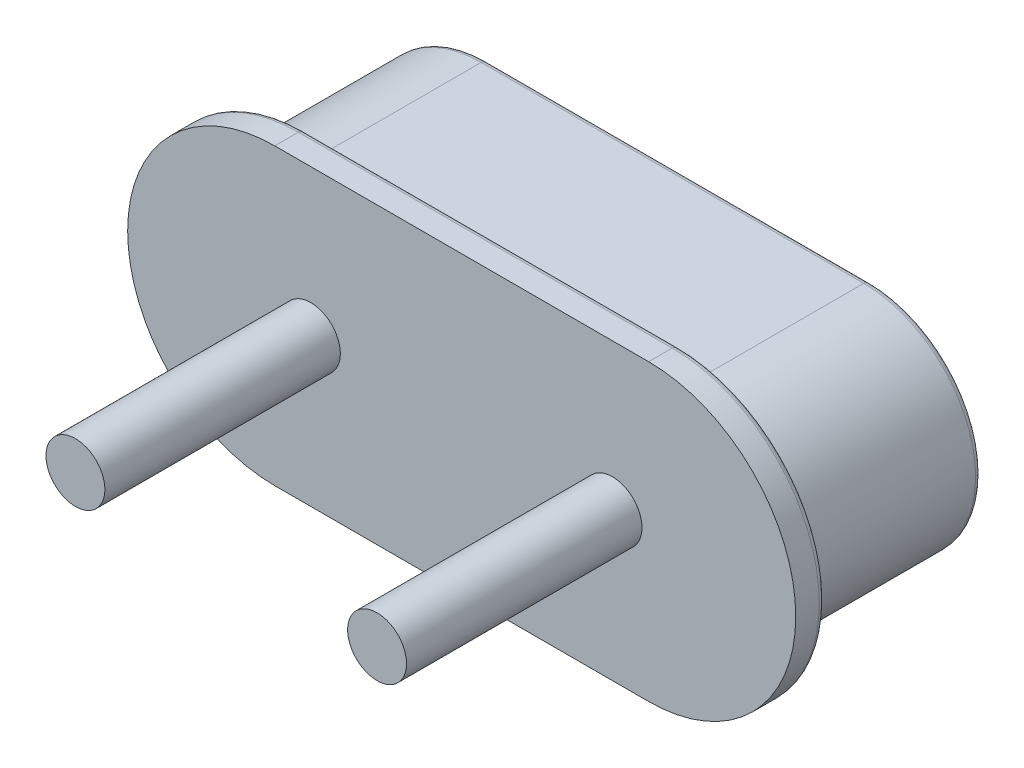
from build123d import *

# Parameters (mm, degrees)
BOSS_EXTRUDE1_DEPTH = 0.5
BOSS_EXTRUDE2_DEPTH = 3.18
FILLET5_R           = 0.1
FILLET6_R           = 0.1
SKETCH7_R           = 0.5
BOSS_EXTRUDE3_DEPTH = 4
BOSS_EXTRUDE4_DEPTH = 0.01


with BuildPart() as part:
    # Sketch1 → Boss-Extrude1 (new body)
    with BuildSketch(Plane.XY):
        with BuildLine():
            Line((-3.175, 2.5), (3.175, 2.5))
            ThreePointArc((3.175, 2.5), (5.675, 0), (3.175, -2.5))
            Line((3.175, -2.5), (-3.175, -2.5))
            ThreePointArc((-3.175, -2.5), (-5.675, 0), (-3.175, 2.5))
        make_face()
    extrude(amount=-BOSS_EXTRUDE1_DEPTH)

    # Sketch3 → Boss-Extrude2 (add)
    with BuildSketch(Plane(origin=(0, 0, -0.5), x_dir=(-1, 0, 0), z_dir=(0, 0, -1))):
        with BuildLine():
            Line((-3.25, 1.9), (3.25, 1.9))
            ThreePointArc((3.25, 1.9), (5.15, 0), (3.25, -1.9))
            Line((3.25, -1.9), (-3.25, -1.9))
            ThreePointArc((-3.25, -1.9), (-5.15, 0), (-3.25, 1.9))
        make_face()
    extrude(amount=BOSS_EXTRUDE2_DEPTH)

    # Fillet5
    fillet5_edges = [part.edges().sort_by_distance(p)[0] for p in [
        (5.15, 0, -3.68),
        (0, -1.9, -3.68),
        (-5.15, 0, -3.68),
        (0, 1.9, -3.68),
    ]]
    fillet(fillet5_edges, radius=FILLET5_R)

    # Fillet6
    fillet6_edges = [part.edges().sort_by_distance(p)[0] for p in [
        (5.675, 0, -0.5),
        (0, 2.5, -0.5),
        (-5.675, 0, -0.5),
        (0, -2.5, -0.5),
    ]]
    fillet(fillet6_edges, radius=FILLET6_R)

    # Sketch7 → Boss-Extrude3 (add)
    with BuildSketch(Plane.XY):
        with Locations((2.5623, 0)):
            Circle(SKETCH7_R)
        with Locations(Location((-2.5623, 0, 0), (0, 0, 180))):
            Circle(SKETCH7_R)
    extrude(amount=BOSS_EXTRUDE3_DEPTH)

    # Sketch8 → Boss-Extrude4 (add)
    # profile 1 of 6: a face of its own
    with BuildSketch(Plane(origin=(0, 0, -3.68), x_dir=(-1, 0, 0), z_dir=(0, 0, -1))):
        Polygon((-2.690553742, 0.764659829), (-2.413209992, 0.764659829), (-2.413209992, -0.735340171), (-2.547825377, -0.735340171), (-2.547825377, 0.610813675), (-2.778594608, 0.610813675), align=None)
    # profile 2 of 6: a face of its own
    with BuildSketch(Plane(origin=(0, 0, -3.68), x_dir=(-1, 0, 0), z_dir=(0, 0, -1))):
        with BuildLine():
            Line((-1.163209992, 0.803121367), (-1.059544127, 0.721691079))
            Line((-1.059544127, 0.721691079), (-1.455878261, 0.115621367))
            add(Edge.make_bspline(
                [(-1.455878261, 0.115621367), (-1.429491, 0.119827307), (-1.378019663, 0.12803147), (-1.325919992, 0.129384875), (-1.300529704, 0.130044444)],
                knots=[0, 0, 0, 0, 1.025318673, 2, 2, 2, 2], degree=3))
            add(Edge.make_bspline(
                [(-1.300529704, 0.130044444), (-1.285284348, 0.129634682), (-1.255274319, 0.128828077), (-1.211214261, 0.122620713), (-1.168876146, 0.112838522), (-1.128435455, 0.098578984), (-1.089747034, 0.080363689), (-1.052588864, 0.058532745), (-1.017659432, 0.031958882), (-0.984508926, 0.0022739), (-0.954411599, -0.030604807), (-0.927764718, -0.065491094), (-0.905381807, -0.102348615), (-0.887221555, -0.1411587), (-0.873119464, -0.181861526), (-0.862839045, -0.224405014), (-0.856762076, -0.268818502), (-0.855936866, -0.299023434), (-0.855517685, -0.314366614)],
                knots=[0, 0, 0, 0, 1.04369286, 2.054478336, 3.041073146, 4.015093852, 4.984733326, 5.965804835, 6.960378782, 7.985147595, 9.009457201, 10.008161701, 10.986880575, 11.956520048, 12.937015923, 13.931873656, 14.949455224, 16, 16, 16, 16], degree=3))
            add(Edge.make_bspline(
                [(-0.855517685, -0.314366614), (-0.856127587, -0.335357915), (-0.85732773, -0.376663829), (-0.869286499, -0.436825275), (-0.887869204, -0.49413921), (-0.914431002, -0.547690569), (-0.947423452, -0.597405956), (-0.987656706, -0.64145687), (-1.033703915, -0.680744029), (-1.085769686, -0.713596866), (-1.141802385, -0.740426745), (-1.200667527, -0.759697563), (-1.261793446, -0.771561907), (-1.303281136, -0.773049308), (-1.324267685, -0.77380171)],
                knots=[0, 0, 0, 0, 1.031375318, 2.029502543, 3.004789286, 3.987476834, 4.960371455, 5.9300674, 6.912260825, 7.929083631, 8.949397511, 9.960523116, 10.96833055, 12, 12, 12, 12], degree=3))
            add(Edge.make_bspline(
                [(-1.324267685, -0.77380171), (-1.344451985, -0.773146764), (-1.38443355, -0.771849432), (-1.443247604, -0.760292602), (-1.499760326, -0.741560986), (-1.553575775, -0.715754867), (-1.603427466, -0.683158631), (-1.648027025, -0.643917655), (-1.687152071, -0.598870741), (-1.719712623, -0.548024878), (-1.745537794, -0.493386325), (-1.764904904, -0.436413258), (-1.77621758, -0.377313266), (-1.77779839, -0.33724992), (-1.778594608, -0.31707094)],
                knots=[0, 0, 0, 0, 1.012016664, 2.004627821, 2.994792927, 3.992885782, 4.990978636, 5.973936114, 6.964471063, 7.975201453, 8.993600317, 9.990122807, 10.98767138, 12, 12, 12, 12], degree=3))
            add(Edge.make_bspline(
                [(-1.778594608, -0.31707094), (-1.778088274, -0.301623262), (-1.777054438, -0.270082054), (-1.769835842, -0.222311756), (-1.758236644, -0.173432721), (-1.745246538, -0.131966638), (-1.731521277, -0.097997415), (-1.72009876, -0.070610204), (-1.705881333, -0.042426887), (-1.690721313, -0.012481043), (-1.673254083, 0.018455571), (-1.654261662, 0.050900001), (-1.633218954, 0.084336255), (-1.618467456, 0.107026625), (-1.610926338, 0.118626175)],
                knots=[0, 0, 0, 0, 1.173818275, 2.396712641, 3.66331629, 4.989737886, 5.693666774, 6.447286557, 7.243889047, 8.091586357, 8.998013824, 9.943181721, 10.948533338, 12, 12, 12, 12], degree=3))
            Line((-1.610926338, 0.118626175), (-1.163209992, 0.803121367))
        make_face()
        with BuildLine():
            add(Edge.make_bspline(
                [(-1.328774896, -0.02380171), (-1.340201572, -0.024135157), (-1.362521191, -0.024786476), (-1.395267226, -0.028568727), (-1.426258619, -0.035691184), (-1.455905962, -0.044762469), (-1.483654978, -0.057235209), (-1.509707338, -0.07238598), (-1.534163788, -0.090223628), (-1.556768168, -0.110495447), (-1.577262309, -0.132690318), (-1.594911365, -0.15646297), (-1.610135251, -0.181240486), (-1.622513173, -0.20722989), (-1.632151777, -0.234421247), (-1.639123885, -0.262689497), (-1.643004064, -0.292224199), (-1.643649592, -0.312252415), (-1.643979223, -0.322479594)],
                knots=[0, 0, 0, 0, 1.129588631, 2.206414736, 3.251139165, 4.268635594, 5.265702196, 6.250456724, 7.242448911, 8.251968645, 9.246821453, 10.222880186, 11.173611482, 12.116736599, 13.062300278, 14.020270554, 14.989073742, 16, 16, 16, 16], degree=3))
            add(Edge.make_bspline(
                [(-1.643979223, -0.322479594), (-1.643710782, -0.3326153), (-1.64318441, -0.35248991), (-1.638404845, -0.38177813), (-1.631104095, -0.40996309), (-1.620243925, -0.43689949), (-1.607289545, -0.462997912), (-1.590187263, -0.487313034), (-1.571237212, -0.511321636), (-1.548585526, -0.533179409), (-1.524275513, -0.553517962), (-1.498303569, -0.571295214), (-1.471235015, -0.586503574), (-1.442704406, -0.598422616), (-1.413116527, -0.608204453), (-1.382224861, -0.615087944), (-1.350007923, -0.618979598), (-1.328184235, -0.619625967), (-1.317056146, -0.619955556)],
                knots=[0, 0, 0, 0, 0.989467248, 1.94019797, 2.891935182, 3.827694429, 4.772920941, 5.730924762, 6.725747692, 7.756678648, 8.79901574, 9.819492441, 10.826891316, 11.826466727, 12.835195252, 13.867842842, 14.912794438, 16, 16, 16, 16], degree=3))
            add(Edge.make_bspline(
                [(-1.317056146, -0.619955556), (-1.305928075, -0.619625941), (-1.284104423, -0.618979522), (-1.251887226, -0.615088235), (-1.220996518, -0.608203386), (-1.191405157, -0.598426484), (-1.162887401, -0.586489223), (-1.13584252, -0.571389829), (-1.110116195, -0.553408636), (-1.085790223, -0.533214166), (-1.063232821, -0.51119723), (-1.043828273, -0.487527349), (-1.027249745, -0.462801394), (-1.01377795, -0.437002298), (-1.003037397, -0.409946803), (-0.995699625, -0.381782493), (-0.99092993, -0.352488768), (-0.990402201, -0.332614914), (-0.990133069, -0.322479594)],
                knots=[0, 0, 0, 0, 1.087397944, 2.132534446, 3.165364764, 4.174271784, 5.174024072, 6.181601208, 7.194203697, 8.236725232, 9.267838612, 10.269026844, 11.221737037, 12.171628256, 13.107553087, 14.05945871, 15.010357665, 16, 16, 16, 16], degree=3))
            add(Edge.make_bspline(
                [(-0.990133069, -0.322479594), (-0.990368909, -0.312239073), (-0.990831786, -0.292140259), (-0.996067192, -0.262702708), (-1.00332821, -0.23427762), (-1.014292366, -0.207043641), (-1.028536599, -0.181108244), (-1.045886631, -0.156340415), (-1.065957732, -0.132550266), (-1.089142392, -0.11045192), (-1.114381064, -0.090246029), (-1.141216315, -0.072409076), (-1.169291161, -0.057355515), (-1.198577136, -0.044795328), (-1.2294098, -0.035731268), (-1.261291374, -0.028594164), (-1.294629621, -0.024796156), (-1.317248167, -0.024137414), (-1.328774896, -0.02380171)],
                knots=[0, 0, 0, 0, 0.978206639, 1.919901502, 2.851605144, 3.780102724, 4.718870031, 5.675451981, 6.667674623, 7.690630536, 8.733308323, 9.756129687, 10.767539656, 11.776269907, 12.797430371, 13.836405707, 14.897401972, 16, 16, 16, 16], degree=3))
        make_face(mode=Mode.SUBTRACT)
    # profile 3 of 6: a face of its own
    with BuildSketch(Plane(origin=(0, 0, -3.68), x_dir=(-1, 0, 0), z_dir=(0, 0, -1))):
        with BuildLine():
            add(Edge.make_bspline(
                [(-0.461286915, -0.50457094), (-0.452933967, -0.505067298), (-0.436558989, -0.506040348), (-0.412885077, -0.512716065), (-0.391458794, -0.524569777), (-0.372373546, -0.54036811), (-0.356642199, -0.559523395), (-0.344366048, -0.580778784), (-0.337748483, -0.604650895), (-0.336782521, -0.621120756), (-0.336286915, -0.62957094)],
                knots=[0, 0, 0, 0, 1.020151414, 1.999887582, 2.974338812, 3.990962822, 5.007586832, 5.987933904, 6.967670073, 8, 8, 8, 8], degree=3))
            add(Edge.make_bspline(
                [(-0.336286915, -0.62957094), (-0.336799316, -0.637818082), (-0.337809762, -0.654081323), (-0.344350879, -0.677773379), (-0.356735758, -0.699042052), (-0.372265041, -0.718457254), (-0.391463512, -0.734289056), (-0.412935732, -0.746041918), (-0.436503414, -0.753195624), (-0.452924696, -0.754106894), (-0.461286915, -0.75457094)],
                knots=[0, 0, 0, 0, 1.009421747, 1.99056486, 2.972319754, 3.999869655, 5.017953583, 5.993804169, 6.978383603, 8, 8, 8, 8], degree=3))
            add(Edge.make_bspline(
                [(-0.461286915, -0.75457094), (-0.469655161, -0.754123685), (-0.485992167, -0.753250524), (-0.509471879, -0.745895035), (-0.531074866, -0.734399267), (-0.550269599, -0.718427734), (-0.565928944, -0.699141958), (-0.577768394, -0.677626903), (-0.584878458, -0.654149144), (-0.585813546, -0.63783144), (-0.586286915, -0.62957094)],
                knots=[0, 0, 0, 0, 1.022052826, 1.995314843, 2.982371812, 4.00089066, 5.028879526, 6.005146991, 6.990147033, 8, 8, 8, 8], degree=3))
            add(Edge.make_bspline(
                [(-0.586286915, -0.62957094), (-0.58583173, -0.621106921), (-0.584943036, -0.604581961), (-0.577753468, -0.5809252), (-0.566020805, -0.559424441), (-0.55016135, -0.540397335), (-0.531079509, -0.524459919), (-0.509523993, -0.512860722), (-0.485935618, -0.50598626), (-0.469645645, -0.505050896), (-0.461286915, -0.50457094)],
                knots=[0, 0, 0, 0, 1.032775665, 2.016367738, 2.991239715, 4.008302682, 5.025365648, 6.011011707, 6.979408107, 8, 8, 8, 8], degree=3))
        make_face()
    # profile 4 of 6: a face of its own
    with BuildSketch(Plane(origin=(0, 0, -3.68), x_dir=(-1, 0, 0), z_dir=(0, 0, -1))):
        with BuildLine():
            add(Edge.make_bspline(
                [(-0.143979223, 0.014058867), (-0.143838644, 0.038100605), (-0.143565567, 0.084802027), (-0.140527672, 0.152852588), (-0.135481097, 0.216692711), (-0.12856508, 0.276325454), (-0.120148803, 0.33176621), (-0.108913594, 0.38286682), (-0.096136679, 0.429863795), (-0.081328488, 0.472910387), (-0.064619435, 0.512586545), (-0.046433323, 0.549625917), (-0.026048411, 0.58397246), (-0.004629734, 0.61617437), (0.018689725, 0.645704525), (0.043246349, 0.672979952), (0.069998582, 0.697370273), (0.098037014, 0.719590117), (0.127615499, 0.739068462), (0.157890927, 0.75622535), (0.189071687, 0.770882436), (0.221242908, 0.782406909), (0.254115433, 0.791925843), (0.287804176, 0.798435392), (0.32236476, 0.80253121), (0.345692518, 0.802922782), (0.357523181, 0.803121367)],
                knots=[0, 0, 0, 0, 1.646270934, 3.197905019, 4.663502075, 6.030701355, 7.308322542, 8.50163776, 9.611534131, 10.641858119, 11.616356847, 12.558055219, 13.465016945, 14.349605745, 15.204443733, 16.039544428, 16.859896111, 17.680448484, 18.487036065, 19.28249412, 20.06191084, 20.843045899, 21.620316918, 22.403196591, 23.190181807, 24, 24, 24, 24], degree=3))
            add(Edge.make_bspline(
                [(0.357523181, 0.803121367), (0.369452672, 0.802912304), (0.393176675, 0.802496542), (0.428251122, 0.798500566), (0.462515271, 0.791870085), (0.495823045, 0.782475382), (0.528448039, 0.770820092), (0.560135071, 0.756211327), (0.591080963, 0.739206098), (0.620793944, 0.719224437), (0.649600207, 0.696946318), (0.676792191, 0.671762317), (0.702372371, 0.643926723), (0.726661788, 0.613737353), (0.748971329, 0.580615174), (0.770217086, 0.54513627), (0.789233673, 0.506680185), (0.807548534, 0.465888556), (0.823357242, 0.421632702), (0.837614204, 0.37416209), (0.849133762, 0.32291601), (0.858729165, 0.268163334), (0.866162692, 0.209702984), (0.871576681, 0.147660277), (0.874436575, 0.081994395), (0.874975161, 0.037098174), (0.875251546, 0.014058867)],
                knots=[0, 0, 0, 0, 0.810914788, 1.612654377, 2.396697861, 3.181598691, 3.963628158, 4.749916497, 5.551656086, 6.361998678, 7.18212741, 8.025565596, 8.878627764, 9.750805457, 10.657531673, 11.591944965, 12.560506719, 13.57287815, 14.630710178, 15.753379473, 16.941251878, 18.199788006, 19.531962791, 20.947069417, 22.433333509, 24, 24, 24, 24], degree=3))
            add(Edge.make_bspline(
                [(0.875251546, 0.014058867), (0.874972296, -0.00887995), (0.874428187, -0.053575301), (0.871608742, -0.118945719), (0.866055043, -0.180659166), (0.859107905, -0.23886365), (0.849486063, -0.293316916), (0.837655278, -0.344207393), (0.824519425, -0.391754853), (0.808304514, -0.435569772), (0.790557066, -0.476263368), (0.771247696, -0.514263574), (0.750560628, -0.549906271), (0.728022595, -0.582906162), (0.703999703, -0.613497015), (0.677977794, -0.641138854), (0.6506904, -0.666497713), (0.621799365, -0.689062696), (0.591622986, -0.708813327), (0.560783381, -0.726476406), (0.52873336, -0.740718989), (0.496199237, -0.752948292), (0.462715652, -0.762291343), (0.428324341, -0.768751567), (0.39320024, -0.773282359), (0.369456712, -0.773627993), (0.357523181, -0.77380171)],
                knots=[0, 0, 0, 0, 1.561518951, 3.042555995, 4.452378317, 5.7783523, 7.031515105, 8.214008947, 9.334062868, 10.386615937, 11.391082383, 12.354592575, 13.286541444, 14.194233754, 15.072674879, 15.931287219, 16.775624067, 17.606195743, 18.42308326, 19.229000347, 20.022332153, 20.807536673, 21.593273796, 22.3848459, 23.188221202, 24, 24, 24, 24], degree=3))
            add(Edge.make_bspline(
                [(0.357523181, -0.77380171), (0.345692846, -0.773601843), (0.322365736, -0.773207745), (0.28780041, -0.769130432), (0.254250792, -0.762575216), (0.221551326, -0.753396671), (0.189534248, -0.742161742), (0.158635839, -0.727524449), (0.128512546, -0.71066699), (0.099244737, -0.691468953), (0.071382382, -0.669473946), (0.044768694, -0.645146393), (0.020072257, -0.617879217), (-0.002913784, -0.588102964), (-0.024759822, -0.556091575), (-0.044855267, -0.521407986), (-0.063442776, -0.484189725), (-0.080432844, -0.444196334), (-0.095496557, -0.400844222), (-0.108802717, -0.353637432), (-0.119308785, -0.302159302), (-0.12830148, -0.246823287), (-0.135554787, -0.187391603), (-0.140506641, -0.123831984), (-0.143567204, -0.056184037), (-0.143839377, -0.009782705), (-0.143979223, 0.014058867)],
                knots=[0, 0, 0, 0, 0.810891512, 1.598919785, 2.382837074, 3.152667961, 3.926044502, 4.706494248, 5.493654104, 6.291793342, 7.103789334, 7.925228297, 8.761435821, 9.622817696, 10.50288917, 11.416980706, 12.369136599, 13.353924996, 14.394355917, 15.514179734, 16.714354668, 17.994756427, 19.357759367, 20.818452758, 22.365282078, 24, 24, 24, 24], degree=3))
        make_face()
        with BuildLine():
            add(Edge.make_bspline(
                [(-0.009363838, 0.014659829), (-0.009312647, -0.005375328), (-0.009213294, -0.044259633), (-0.006617779, -0.100763888), (-0.003081966, -0.153465457), (0.00147859, -0.202431258), (0.008251282, -0.247495549), (0.015839906, -0.288968271), (0.025074801, -0.326629944), (0.036001238, -0.360739006), (0.048446565, -0.391874321), (0.062034792, -0.42084627), (0.076632245, -0.4479971), (0.092969024, -0.473082932), (0.110761194, -0.496185574), (0.129606876, -0.51771393), (0.150209412, -0.536912637), (0.178711016, -0.559938432), (0.216338077, -0.583732346), (0.263746843, -0.604452099), (0.312461894, -0.617473152), (0.345526715, -0.619129047), (0.362030392, -0.619955556)],
                knots=[0, 0, 0, 0, 1.459021318, 2.831673884, 4.118529203, 5.306027144, 6.411944654, 7.436330062, 8.375795394, 9.233974572, 10.042671642, 10.816086306, 11.563610507, 12.285937304, 12.993564865, 13.685989202, 14.367179055, 15.041617293, 16.353048772, 17.594441528, 18.799311195, 20, 20, 20, 20], degree=3))
            add(Edge.make_bspline(
                [(0.362030392, -0.619955556), (0.378640823, -0.619270793), (0.41182739, -0.61790268), (0.460313302, -0.604703221), (0.507383418, -0.584787704), (0.544271393, -0.561238773), (0.57233534, -0.538812346), (0.592442621, -0.519691783), (0.610897785, -0.498282125), (0.628401531, -0.475182427), (0.644455421, -0.449951363), (0.659053908, -0.422710259), (0.672375343, -0.393383468), (0.679964934, -0.372910723), (0.683845296, -0.362443537)],
                knots=[0, 0, 0, 0, 1.353760809, 2.704726607, 4.075137775, 5.516104923, 6.260822281, 7.007110065, 7.778089737, 8.566572457, 9.372053459, 10.217411131, 11.088608312, 12, 12, 12, 12], degree=3))
            add(Edge.make_bspline(
                [(0.683845296, -0.362443537), (0.688367482, -0.349059363), (0.69754946, -0.321883749), (0.709383077, -0.279727898), (0.718702534, -0.235498142), (0.727086834, -0.189458807), (0.732809572, -0.141270363), (0.737415778, -0.091081913), (0.740128929, -0.038855615), (0.740465251, -0.003372047), (0.740636162, 0.014659829)],
                knots=[0, 0, 0, 0, 0.884706709, 1.796334032, 2.740027952, 3.714592787, 4.726048262, 5.777819803, 6.87074269, 8, 8, 8, 8], degree=3))
            add(Edge.make_bspline(
                [(0.740636162, 0.014659829), (0.740400366, 0.032688788), (0.7399391, 0.067957288), (0.738175962, 0.119607936), (0.733623002, 0.168665548), (0.728566237, 0.215341465), (0.721110285, 0.259377309), (0.713071225, 0.301141726), (0.702270705, 0.340117308), (0.690733659, 0.376914271), (0.677529204, 0.411114552), (0.662993889, 0.442877603), (0.647470278, 0.472356771), (0.630609318, 0.499471174), (0.612611168, 0.524342264), (0.59300079, 0.546471376), (0.572556058, 0.566544363), (0.543920122, 0.589456892), (0.50643114, 0.612819047), (0.459783006, 0.634318659), (0.411238444, 0.64666507), (0.378421249, 0.648405793), (0.362030392, 0.649275213)],
                knots=[0, 0, 0, 0, 1.31362396, 2.569729283, 3.763502607, 4.902122613, 5.988968491, 7.01645872, 7.998833611, 8.933434873, 9.825090667, 10.667526885, 11.477055099, 12.250526234, 12.991942729, 13.710640831, 14.402115721, 15.076753259, 16.378508321, 17.609869233, 18.806226677, 20, 20, 20, 20], degree=3))
            add(Edge.make_bspline(
                [(0.362030392, 0.649275213), (0.345440139, 0.648404593), (0.312229408, 0.646661767), (0.263180284, 0.634364659), (0.216164133, 0.61293053), (0.178774287, 0.589379514), (0.150118379, 0.566948809), (0.129940082, 0.547497471), (0.111020293, 0.526220505), (0.093591279, 0.502905399), (0.077267301, 0.477848813), (0.062275438, 0.450853628), (0.048768011, 0.421783043), (0.03630321, 0.390661714), (0.025343444, 0.356555595), (0.016303174, 0.318940312), (0.007951579, 0.277599501), (0.002039321, 0.23229114), (-0.003216574, 0.183313075), (-0.006594295, 0.130479938), (-0.009221976, 0.073880918), (-0.009315604, 0.034795564), (-0.009363838, 0.014659829)],
                knots=[0, 0, 0, 0, 1.207732386, 2.417664972, 3.655092373, 4.956220595, 5.625982001, 6.301752483, 6.994047911, 7.697131622, 8.419323945, 9.170223765, 9.943494443, 10.752040957, 11.610060368, 12.549350801, 13.567764191, 14.679664412, 15.874934091, 17.154273443, 18.533957287, 20, 20, 20, 20], degree=3))
        make_face(mode=Mode.SUBTRACT)
    # profile 5 of 6: a face of its own
    with BuildSketch(Plane(origin=(0, 0, -3.68), x_dir=(-1, 0, 0), z_dir=(0, 0, -1))):
        with BuildLine():
            add(Edge.make_bspline(
                [(1.009866931, 0.014058867), (1.01000751, 0.038100605), (1.010280587, 0.084802027), (1.013318482, 0.152852588), (1.018365057, 0.216692711), (1.025281074, 0.276325454), (1.033697351, 0.33176621), (1.04493256, 0.38286682), (1.057709475, 0.429863795), (1.072517666, 0.472910387), (1.089226719, 0.512586545), (1.107412831, 0.549625917), (1.127797742, 0.58397246), (1.149216419, 0.61617437), (1.172535879, 0.645704525), (1.197092503, 0.672979952), (1.223844736, 0.697370273), (1.251883168, 0.719590117), (1.281461653, 0.739068462), (1.311737081, 0.75622535), (1.342917841, 0.770882436), (1.375089062, 0.782406909), (1.407961587, 0.791925843), (1.44165033, 0.798435392), (1.476210914, 0.80253121), (1.499538672, 0.802922782), (1.511369335, 0.803121367)],
                knots=[0, 0, 0, 0, 1.646270934, 3.197905019, 4.663502075, 6.030701355, 7.308322542, 8.50163776, 9.611534131, 10.641858119, 11.616356847, 12.558055219, 13.465016945, 14.349605745, 15.204443733, 16.039544428, 16.859896111, 17.680448484, 18.487036065, 19.28249412, 20.06191084, 20.843045899, 21.620316918, 22.403196591, 23.190181807, 24, 24, 24, 24], degree=3))
            add(Edge.make_bspline(
                [(1.511369335, 0.803121367), (1.523298825, 0.802912304), (1.547022829, 0.802496542), (1.582097276, 0.798500566), (1.616361425, 0.791870085), (1.649669199, 0.782475382), (1.682294193, 0.770820092), (1.713981225, 0.756211327), (1.744927117, 0.739206098), (1.774640097, 0.719224437), (1.803446361, 0.696946318), (1.830638345, 0.671762317), (1.856218525, 0.643926723), (1.880507941, 0.613737353), (1.902817483, 0.580615174), (1.92406324, 0.54513627), (1.943079827, 0.506680185), (1.961394687, 0.465888556), (1.977203396, 0.421632702), (1.991460358, 0.37416209), (2.002979916, 0.32291601), (2.012575319, 0.268163334), (2.020008846, 0.209702984), (2.025422835, 0.147660277), (2.028282729, 0.081994395), (2.028821315, 0.037098174), (2.0290977, 0.014058867)],
                knots=[0, 0, 0, 0, 0.810914788, 1.612654377, 2.396697861, 3.181598691, 3.963628158, 4.749916497, 5.551656086, 6.361998678, 7.18212741, 8.025565596, 8.878627764, 9.750805457, 10.657531673, 11.591944965, 12.560506719, 13.57287815, 14.630710178, 15.753379473, 16.941251878, 18.199788006, 19.531962791, 20.947069417, 22.433333509, 24, 24, 24, 24], degree=3))
            add(Edge.make_bspline(
                [(2.0290977, 0.014058867), (2.02881845, -0.00887995), (2.028274341, -0.053575301), (2.025454896, -0.118945719), (2.019901196, -0.180659166), (2.012954059, -0.23886365), (2.003332217, -0.293316916), (1.991501432, -0.344207393), (1.978365579, -0.391754853), (1.962150667, -0.435569772), (1.94440322, -0.476263368), (1.92509385, -0.514263574), (1.904406782, -0.549906271), (1.881868748, -0.582906162), (1.857845857, -0.613497015), (1.831823948, -0.641138854), (1.804536554, -0.666497713), (1.775645519, -0.689062696), (1.74546914, -0.708813327), (1.714629535, -0.726476406), (1.682579514, -0.740718989), (1.650045391, -0.752948292), (1.616561806, -0.762291343), (1.582170495, -0.768751567), (1.547046394, -0.773282359), (1.523302866, -0.773627993), (1.511369335, -0.77380171)],
                knots=[0, 0, 0, 0, 1.561518951, 3.042555995, 4.452378317, 5.7783523, 7.031515105, 8.214008947, 9.334062868, 10.386615937, 11.391082383, 12.354592575, 13.286541444, 14.194233754, 15.072674879, 15.931287219, 16.775624067, 17.606195743, 18.42308326, 19.229000347, 20.022332153, 20.807536673, 21.593273796, 22.3848459, 23.188221202, 24, 24, 24, 24], degree=3))
            add(Edge.make_bspline(
                [(1.511369335, -0.77380171), (1.499539, -0.773601843), (1.476211889, -0.773207745), (1.441646564, -0.769130432), (1.408096946, -0.762575216), (1.37539748, -0.753396671), (1.343380402, -0.742161742), (1.312481993, -0.727524449), (1.2823587, -0.71066699), (1.25309089, -0.691468953), (1.225228536, -0.669473946), (1.198614848, -0.645146393), (1.173918411, -0.617879217), (1.15093237, -0.588102964), (1.129086332, -0.556091575), (1.108990887, -0.521407986), (1.090403378, -0.484189725), (1.07341331, -0.444196334), (1.058349597, -0.400844222), (1.045043437, -0.353637432), (1.034537369, -0.302159302), (1.025544674, -0.246823287), (1.018291367, -0.187391603), (1.013339513, -0.123831984), (1.01027895, -0.056184037), (1.010006777, -0.009782705), (1.009866931, 0.014058867)],
                knots=[0, 0, 0, 0, 0.810891512, 1.598919785, 2.382837074, 3.152667961, 3.926044502, 4.706494248, 5.493654104, 6.291793342, 7.103789334, 7.925228297, 8.761435821, 9.622817696, 10.50288917, 11.416980706, 12.369136599, 13.353924996, 14.394355917, 15.514179734, 16.714354668, 17.994756427, 19.357759367, 20.818452758, 22.365282078, 24, 24, 24, 24], degree=3))
        make_face()
        with BuildLine():
            add(Edge.make_bspline(
                [(1.144482315, 0.014659829), (1.144533507, -0.005375328), (1.14463286, -0.044259633), (1.147228374, -0.100763888), (1.150764188, -0.153465457), (1.155324744, -0.202431258), (1.162097436, -0.247495549), (1.16968606, -0.288968271), (1.178920955, -0.326629944), (1.189847391, -0.360739006), (1.202292719, -0.391874321), (1.215880946, -0.42084627), (1.230478399, -0.4479971), (1.246815177, -0.473082932), (1.264607347, -0.496185574), (1.28345303, -0.51771393), (1.304055566, -0.536912637), (1.33255717, -0.559938432), (1.37018423, -0.583732346), (1.417592997, -0.604452099), (1.466308047, -0.617473152), (1.499372869, -0.619129047), (1.515876546, -0.619955556)],
                knots=[0, 0, 0, 0, 1.459021318, 2.831673884, 4.118529203, 5.306027144, 6.411944654, 7.436330062, 8.375795394, 9.233974572, 10.042671642, 10.816086306, 11.563610507, 12.285937304, 12.993564865, 13.685989202, 14.367179055, 15.041617293, 16.353048772, 17.594441528, 18.799311195, 20, 20, 20, 20], degree=3))
            add(Edge.make_bspline(
                [(1.515876546, -0.619955556), (1.532486977, -0.619270793), (1.565673544, -0.61790268), (1.614159456, -0.604703221), (1.661229572, -0.584787704), (1.698117546, -0.561238773), (1.726181494, -0.538812346), (1.746288775, -0.519691783), (1.764743939, -0.498282125), (1.782247685, -0.475182427), (1.798301575, -0.449951363), (1.812900062, -0.422710259), (1.826221497, -0.393383468), (1.833811088, -0.372910723), (1.83769145, -0.362443537)],
                knots=[0, 0, 0, 0, 1.353760809, 2.704726607, 4.075137775, 5.516104923, 6.260822281, 7.007110065, 7.778089737, 8.566572457, 9.372053459, 10.217411131, 11.088608312, 12, 12, 12, 12], degree=3))
            add(Edge.make_bspline(
                [(1.83769145, -0.362443537), (1.842213636, -0.349059363), (1.851395614, -0.321883749), (1.863229231, -0.279727898), (1.872548688, -0.235498142), (1.880932988, -0.189458807), (1.886655726, -0.141270363), (1.891261932, -0.091081913), (1.893975083, -0.038855615), (1.894311405, -0.003372047), (1.894482315, 0.014659829)],
                knots=[0, 0, 0, 0, 0.884706709, 1.796334032, 2.740027952, 3.714592787, 4.726048262, 5.777819803, 6.87074269, 8, 8, 8, 8], degree=3))
            add(Edge.make_bspline(
                [(1.894482315, 0.014659829), (1.89424652, 0.032688788), (1.893785254, 0.067957288), (1.892022116, 0.119607936), (1.887469156, 0.168665548), (1.882412391, 0.215341465), (1.874956439, 0.259377309), (1.866917379, 0.301141726), (1.856116859, 0.340117308), (1.844579813, 0.376914271), (1.831375357, 0.411114552), (1.816840043, 0.442877603), (1.801316432, 0.472356771), (1.784455472, 0.499471174), (1.766457322, 0.524342264), (1.746846943, 0.546471376), (1.726402212, 0.566544363), (1.697766276, 0.589456892), (1.660277294, 0.612819047), (1.61362916, 0.634318659), (1.565084598, 0.64666507), (1.532267403, 0.648405793), (1.515876546, 0.649275213)],
                knots=[0, 0, 0, 0, 1.31362396, 2.569729283, 3.763502607, 4.902122613, 5.988968491, 7.01645872, 7.998833611, 8.933434873, 9.825090667, 10.667526885, 11.477055099, 12.250526234, 12.991942729, 13.710640831, 14.402115721, 15.076753259, 16.378508321, 17.609869233, 18.806226677, 20, 20, 20, 20], degree=3))
            add(Edge.make_bspline(
                [(1.515876546, 0.649275213), (1.499286292, 0.648404593), (1.466075561, 0.646661767), (1.417026438, 0.634364659), (1.370010287, 0.61293053), (1.332620441, 0.589379514), (1.303964533, 0.566948809), (1.283786235, 0.547497471), (1.264866447, 0.526220505), (1.247437433, 0.502905399), (1.231113454, 0.477848813), (1.216121592, 0.450853628), (1.202614165, 0.421783043), (1.190149364, 0.390661714), (1.179189597, 0.356555595), (1.170149327, 0.318940312), (1.161797733, 0.277599501), (1.155885475, 0.23229114), (1.15062958, 0.183313075), (1.147251859, 0.130479938), (1.144624177, 0.073880918), (1.14453055, 0.034795564), (1.144482315, 0.014659829)],
                knots=[0, 0, 0, 0, 1.207732386, 2.417664972, 3.655092373, 4.956220595, 5.625982001, 6.301752483, 6.994047911, 7.697131622, 8.419323945, 9.170223765, 9.943494443, 10.752040957, 11.610060368, 12.549350801, 13.567764191, 14.679664412, 15.874934091, 17.154273443, 18.533957287, 20, 20, 20, 20], degree=3))
        make_face(mode=Mode.SUBTRACT)
    # profile 6 of 6: a face of its own
    with BuildSketch(Plane(origin=(0, 0, -3.68), x_dir=(-1, 0, 0), z_dir=(0, 0, -1))):
        with BuildLine():
            add(Edge.make_bspline(
                [(2.163713085, 0.014058867), (2.163853664, 0.038100605), (2.164126741, 0.084802027), (2.167164636, 0.152852588), (2.172211211, 0.216692711), (2.179127228, 0.276325454), (2.187543505, 0.33176621), (2.198778714, 0.38286682), (2.211555629, 0.429863795), (2.22636382, 0.472910387), (2.243072873, 0.512586545), (2.261258984, 0.549625917), (2.281643896, 0.58397246), (2.303062573, 0.61617437), (2.326382032, 0.645704525), (2.350938657, 0.672979952), (2.37769089, 0.697370273), (2.405729322, 0.719590117), (2.435307807, 0.739068462), (2.465583235, 0.75622535), (2.496763995, 0.770882436), (2.528935216, 0.782406909), (2.561807741, 0.791925843), (2.595496483, 0.798435392), (2.630057068, 0.80253121), (2.653384826, 0.802922782), (2.665215489, 0.803121367)],
                knots=[0, 0, 0, 0, 1.646270934, 3.197905019, 4.663502075, 6.030701355, 7.308322542, 8.50163776, 9.611534131, 10.641858119, 11.616356847, 12.558055219, 13.465016945, 14.349605745, 15.204443733, 16.039544428, 16.859896111, 17.680448484, 18.487036065, 19.28249412, 20.06191084, 20.843045899, 21.620316918, 22.403196591, 23.190181807, 24, 24, 24, 24], degree=3))
            add(Edge.make_bspline(
                [(2.665215489, 0.803121367), (2.677144979, 0.802912304), (2.700868983, 0.802496542), (2.73594343, 0.798500566), (2.770207579, 0.791870085), (2.803515353, 0.782475382), (2.836140347, 0.770820092), (2.867827379, 0.756211327), (2.898773271, 0.739206098), (2.928486251, 0.719224437), (2.957292515, 0.696946318), (2.984484499, 0.671762317), (3.010064679, 0.643926723), (3.034354095, 0.613737353), (3.056663637, 0.580615174), (3.077909394, 0.54513627), (3.09692598, 0.506680185), (3.115240841, 0.465888556), (3.13104955, 0.421632702), (3.145306512, 0.37416209), (3.15682607, 0.32291601), (3.166421473, 0.268163334), (3.173854999, 0.209702984), (3.179268989, 0.147660277), (3.182128882, 0.081994395), (3.182667469, 0.037098174), (3.182943854, 0.014058867)],
                knots=[0, 0, 0, 0, 0.810914788, 1.612654377, 2.396697861, 3.181598691, 3.963628158, 4.749916497, 5.551656086, 6.361998678, 7.18212741, 8.025565596, 8.878627764, 9.750805457, 10.657531673, 11.591944965, 12.560506719, 13.57287815, 14.630710178, 15.753379473, 16.941251878, 18.199788006, 19.531962791, 20.947069417, 22.433333509, 24, 24, 24, 24], degree=3))
            add(Edge.make_bspline(
                [(3.182943854, 0.014058867), (3.182664603, -0.00887995), (3.182120495, -0.053575301), (3.179301049, -0.118945719), (3.17374735, -0.180659166), (3.166800212, -0.23886365), (3.157178371, -0.293316916), (3.145347586, -0.344207393), (3.132211733, -0.391754853), (3.115996821, -0.435569772), (3.098249374, -0.476263368), (3.078940004, -0.514263574), (3.058252936, -0.549906271), (3.035714902, -0.582906162), (3.011692011, -0.613497015), (2.985670101, -0.641138854), (2.958382708, -0.666497713), (2.929491672, -0.689062696), (2.899315293, -0.708813327), (2.868475689, -0.726476406), (2.836425668, -0.740718989), (2.803891545, -0.752948292), (2.770407959, -0.762291343), (2.736016649, -0.768751567), (2.700892548, -0.773282359), (2.67714902, -0.773627993), (2.665215489, -0.77380171)],
                knots=[0, 0, 0, 0, 1.561518951, 3.042555995, 4.452378317, 5.7783523, 7.031515105, 8.214008947, 9.334062868, 10.386615937, 11.391082383, 12.354592575, 13.286541444, 14.194233754, 15.072674879, 15.931287219, 16.775624067, 17.606195743, 18.42308326, 19.229000347, 20.022332153, 20.807536673, 21.593273796, 22.3848459, 23.188221202, 24, 24, 24, 24], degree=3))
            add(Edge.make_bspline(
                [(2.665215489, -0.77380171), (2.653385154, -0.773601843), (2.630058043, -0.773207745), (2.595492718, -0.769130432), (2.5619431, -0.762575216), (2.529243634, -0.753396671), (2.497226556, -0.742161742), (2.466328147, -0.727524449), (2.436204854, -0.71066699), (2.406937044, -0.691468953), (2.37907469, -0.669473946), (2.352461002, -0.645146393), (2.327764565, -0.617879217), (2.304778524, -0.588102964), (2.282932486, -0.556091575), (2.26283704, -0.521407986), (2.244249531, -0.484189725), (2.227259464, -0.444196334), (2.212195751, -0.400844222), (2.19888959, -0.353637432), (2.188383523, -0.302159302), (2.179390828, -0.246823287), (2.172137521, -0.187391603), (2.167185667, -0.123831984), (2.164125104, -0.056184037), (2.163852931, -0.009782705), (2.163713085, 0.014058867)],
                knots=[0, 0, 0, 0, 0.810891512, 1.598919785, 2.382837074, 3.152667961, 3.926044502, 4.706494248, 5.493654104, 6.291793342, 7.103789334, 7.925228297, 8.761435821, 9.622817696, 10.50288917, 11.416980706, 12.369136599, 13.353924996, 14.394355917, 15.514179734, 16.714354668, 17.994756427, 19.357759367, 20.818452758, 22.365282078, 24, 24, 24, 24], degree=3))
        make_face()
        with BuildLine():
            add(Edge.make_bspline(
                [(2.298328469, 0.014659829), (2.298379661, -0.005375328), (2.298479014, -0.044259633), (2.301074528, -0.100763888), (2.304610342, -0.153465457), (2.309170898, -0.202431258), (2.31594359, -0.247495549), (2.323532213, -0.288968271), (2.332767109, -0.326629944), (2.343693545, -0.360739006), (2.356138873, -0.391874321), (2.3697271, -0.42084627), (2.384324552, -0.4479971), (2.400661331, -0.473082932), (2.418453501, -0.496185574), (2.437299184, -0.51771393), (2.45790172, -0.536912637), (2.486403324, -0.559938432), (2.524030384, -0.583732346), (2.571439151, -0.604452099), (2.620154201, -0.617473152), (2.653219023, -0.619129047), (2.6697227, -0.619955556)],
                knots=[0, 0, 0, 0, 1.459021318, 2.831673884, 4.118529203, 5.306027144, 6.411944654, 7.436330062, 8.375795394, 9.233974572, 10.042671642, 10.816086306, 11.563610507, 12.285937304, 12.993564865, 13.685989202, 14.367179055, 15.041617293, 16.353048772, 17.594441528, 18.799311195, 20, 20, 20, 20], degree=3))
            add(Edge.make_bspline(
                [(2.6697227, -0.619955556), (2.686333131, -0.619270793), (2.719519698, -0.61790268), (2.76800561, -0.604703221), (2.815075726, -0.584787704), (2.8519637, -0.561238773), (2.880027647, -0.538812346), (2.900134929, -0.519691783), (2.918590093, -0.498282125), (2.936093839, -0.475182427), (2.952147728, -0.449951363), (2.966746216, -0.422710259), (2.980067651, -0.393383468), (2.987657242, -0.372910723), (2.991537604, -0.362443537)],
                knots=[0, 0, 0, 0, 1.353760809, 2.704726607, 4.075137775, 5.516104923, 6.260822281, 7.007110065, 7.778089737, 8.566572457, 9.372053459, 10.217411131, 11.088608312, 12, 12, 12, 12], degree=3))
            add(Edge.make_bspline(
                [(2.991537604, -0.362443537), (2.99605979, -0.349059363), (3.005241767, -0.321883749), (3.017075385, -0.279727898), (3.026394842, -0.235498142), (3.034779141, -0.189458807), (3.04050188, -0.141270363), (3.045108085, -0.091081913), (3.047821237, -0.038855615), (3.048157559, -0.003372047), (3.048328469, 0.014659829)],
                knots=[0, 0, 0, 0, 0.884706709, 1.796334032, 2.740027952, 3.714592787, 4.726048262, 5.777819803, 6.87074269, 8, 8, 8, 8], degree=3))
            add(Edge.make_bspline(
                [(3.048328469, 0.014659829), (3.048092674, 0.032688788), (3.047631408, 0.067957288), (3.04586827, 0.119607936), (3.04131531, 0.168665548), (3.036258544, 0.215341465), (3.028802593, 0.259377309), (3.020763532, 0.301141726), (3.009963013, 0.340117308), (2.998425966, 0.376914271), (2.985221511, 0.411114552), (2.970686197, 0.442877603), (2.955162586, 0.472356771), (2.938301625, 0.499471174), (2.920303476, 0.524342264), (2.900693097, 0.546471376), (2.880248366, 0.566544363), (2.851612429, 0.589456892), (2.814123448, 0.612819047), (2.767475313, 0.634318659), (2.718930752, 0.64666507), (2.686113557, 0.648405793), (2.6697227, 0.649275213)],
                knots=[0, 0, 0, 0, 1.31362396, 2.569729283, 3.763502607, 4.902122613, 5.988968491, 7.01645872, 7.998833611, 8.933434873, 9.825090667, 10.667526885, 11.477055099, 12.250526234, 12.991942729, 13.710640831, 14.402115721, 15.076753259, 16.378508321, 17.609869233, 18.806226677, 20, 20, 20, 20], degree=3))
            add(Edge.make_bspline(
                [(2.6697227, 0.649275213), (2.653132446, 0.648404593), (2.619921715, 0.646661767), (2.570872592, 0.634364659), (2.523856441, 0.61293053), (2.486466595, 0.589379514), (2.457810686, 0.566948809), (2.437632389, 0.547497471), (2.418712601, 0.526220505), (2.401283587, 0.502905399), (2.384959608, 0.477848813), (2.369967746, 0.450853628), (2.356460319, 0.421783043), (2.343995518, 0.390661714), (2.333035751, 0.356555595), (2.323995481, 0.318940312), (2.315643887, 0.277599501), (2.309731629, 0.23229114), (2.304475734, 0.183313075), (2.301098013, 0.130479938), (2.298470331, 0.073880918), (2.298376704, 0.034795564), (2.298328469, 0.014659829)],
                knots=[0, 0, 0, 0, 1.207732386, 2.417664972, 3.655092373, 4.956220595, 5.625982001, 6.301752483, 6.994047911, 7.697131622, 8.419323945, 9.170223765, 9.943494443, 10.752040957, 11.610060368, 12.549350801, 13.567764191, 14.679664412, 15.874934091, 17.154273443, 18.533957287, 20, 20, 20, 20], degree=3))
        make_face(mode=Mode.SUBTRACT)
    extrude(amount=BOSS_EXTRUDE4_DEPTH)


solid = part.part
